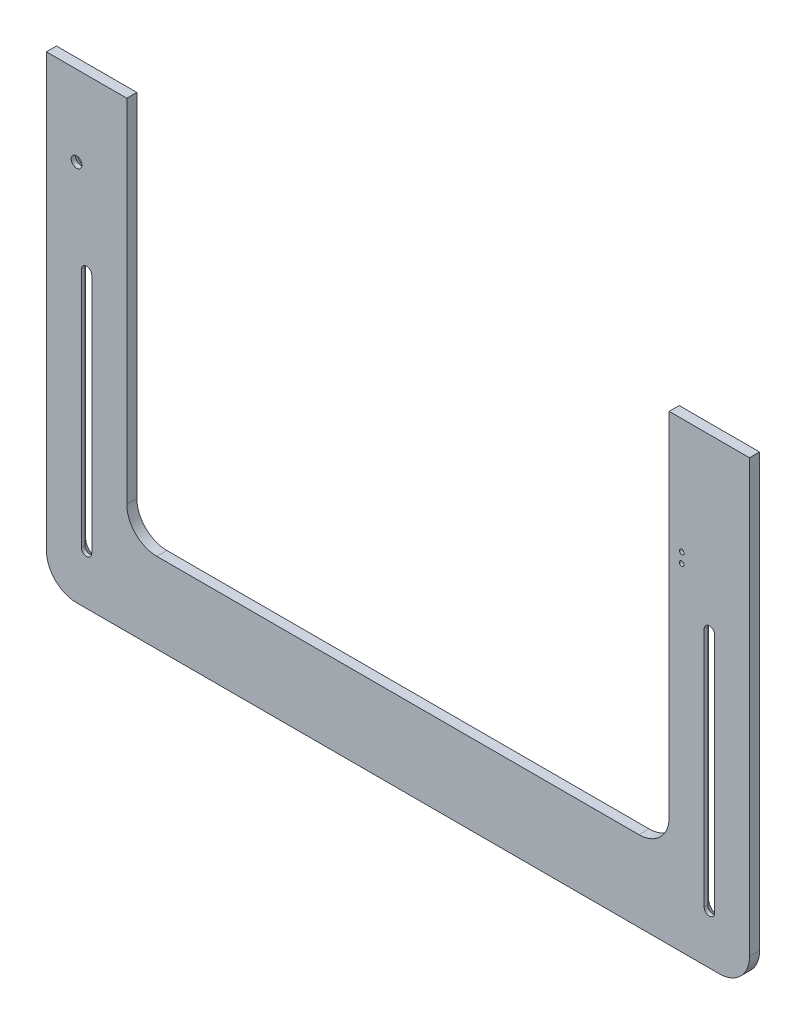
from build123d import *
from OCP.BRepFilletAPI import BRepFilletAPI_MakeChamfer

# Parameters (mm, degrees)
BOSS_EXTRUDE1_DEPTH             = 6.35
FILLET5_R                       = 19.05
FILLET6_R                       = 19.05
FILLET7_R                       = 19.05
FILLET8_R                       = 19.05
CUT_EXTRUDE1_DEPTH              = 532.923850283
CUT_EXTRUDE2_DEPTH              = 532.923850283
CHAMFER1_SIZE                   = 4.0894
CHAMFER1_SIZE2                  = 3.682112299
CHAMFER2_SIZE                   = 4.0894
CHAMFER2_SIZE2                  = 3.682112299
F_32_0_116_DIAMETER_HOLE1_D     = 2.9464
F_32_0_116_DIAMETER_HOLE1_DEPTH = 25.4
F_32_0_116_DIAMETER_HOLE1_TIP   = 0.885187864


with BuildPart() as part:
    # Sketch1 → Boss-Extrude1 (new body)
    with BuildSketch(Plane.XY):
        Polygon((0, 0), (0, -292.1), (444.5, -292.1), (444.5, 0), (393.7, 0), (393.7, -241.3), (50.8, -241.3), (50.8, 0), align=None)
    extrude(amount=BOSS_EXTRUDE1_DEPTH)

    # Fillet5
    fillet5_edges = [part.edges().sort_by_distance(p)[0] for p in [
        (0, -292.1, 3.175),
    ]]
    fillet(fillet5_edges, radius=FILLET5_R)

    # Fillet6
    fillet6_edges = [part.edges().sort_by_distance(p)[0] for p in [
        (444.5, -292.1, 3.175),
    ]]
    fillet(fillet6_edges, radius=FILLET6_R)

    # Fillet7
    fillet7_edges = [part.edges().sort_by_distance(p)[0] for p in [
        (50.8, -241.3, 3.175),
    ]]
    fillet(fillet7_edges, radius=FILLET7_R)

    # Fillet8
    fillet8_edges = [part.edges().sort_by_distance(p)[0] for p in [
        (393.7, -241.3, 3.175),
    ]]
    fillet(fillet8_edges, radius=FILLET8_R)

    # Sketch2 → Cut-Extrude1 (cut, through all)
    with BuildSketch(Plane.XY.offset(6.35)):
        with BuildLine():
            Line((22.1361, -260.35), (22.1361, -107.95))
            ThreePointArc((22.1361, -107.95), (25.4, -104.6861), (28.6639, -107.95))
            Line((28.6639, -107.95), (28.6639, -260.35))
            ThreePointArc((28.6639, -260.35), (25.4, -263.6139), (22.1361, -260.35))
        make_face()
    extrude(amount=-CUT_EXTRUDE1_DEPTH, mode=Mode.SUBTRACT)

    # Sketch4 → Cut-Extrude2 (cut, through all)
    with BuildSketch(Plane.XY.offset(6.35)):
        with BuildLine():
            Line((415.8361, -260.35), (415.8361, -107.95))
            ThreePointArc((415.8361, -107.95), (419.1, -104.6861), (422.3639, -107.95))
            Line((422.3639, -107.95), (422.3639, -260.35))
            ThreePointArc((422.3639, -260.35), (419.1, -263.6139), (415.8361, -260.35))
        make_face()
    extrude(amount=-CUT_EXTRUDE2_DEPTH, mode=Mode.SUBTRACT)

    # Sketch10 → CSK for 1/4 Flat Head Machine Screw2 (revolve, cut)
    with BuildSketch(Plane(origin=(19.05, -50.8, 0), x_dir=(0, 1, 0), z_dir=(1, 0, 0))):
        Polygon((0, 0), (0, 6.35), (3.3782, 6.35), (3.3782, 3.520932584), (6.4389, 0), align=None)
    revolve(axis=Axis((19.05, -50.8, -6.35), (0, 0, 1)), mode=Mode.SUBTRACT)

    # Chamfer1: one chamfer whose edges measure the first distance from different faces: ONE call of the kernel's chamfer builder (chamfer() names one face for all edges)
    chamfer1_edges_1 = [part.edges().sort_by_distance(p)[0] for p in [
        (419.1, -263.6139, 0),
    ]]
    chamfer1_side_1 = [part.faces().sort_by_distance(p)[0] for p in [
        (419.1, -263.6139, 3.175),
    ]]
    chamfer1_edges_2 = [part.edges().sort_by_distance(p)[0] for p in [
        (415.8361, -184.15, 0),
    ]]
    chamfer1_side_2 = [part.faces().sort_by_distance(p)[0] for p in [
        (415.8361, -184.15, 3.175),
    ]]
    chamfer1_edges_3 = [part.edges().sort_by_distance(p)[0] for p in [
        (419.1, -104.6861, 0),
    ]]
    chamfer1_side_3 = [part.faces().sort_by_distance(p)[0] for p in [
        (419.1, -104.6861, 3.175),
    ]]
    chamfer1_edges_4 = [part.edges().sort_by_distance(p)[0] for p in [
        (422.3639, -184.15, 0),
    ]]
    chamfer1_side_4 = [part.faces().sort_by_distance(p)[0] for p in [
        (422.3639, -184.15, 3.175),
    ]]
    chamfer1 = BRepFilletAPI_MakeChamfer(part.part.solid().wrapped)
    for e in chamfer1_edges_1:
        chamfer1.Add(CHAMFER1_SIZE, CHAMFER1_SIZE2, e.wrapped, chamfer1_side_1[0].wrapped)  # the first distance lies on this face
    for e in chamfer1_edges_2:
        chamfer1.Add(CHAMFER1_SIZE, CHAMFER1_SIZE2, e.wrapped, chamfer1_side_2[0].wrapped)  # the first distance lies on this face
    for e in chamfer1_edges_3:
        chamfer1.Add(CHAMFER1_SIZE, CHAMFER1_SIZE2, e.wrapped, chamfer1_side_3[0].wrapped)  # the first distance lies on this face
    for e in chamfer1_edges_4:
        chamfer1.Add(CHAMFER1_SIZE, CHAMFER1_SIZE2, e.wrapped, chamfer1_side_4[0].wrapped)  # the first distance lies on this face
    add(Compound.cast(chamfer1.Shape()), mode=Mode.REPLACE)

    # Chamfer2: one chamfer whose edges measure the first distance from different faces: ONE call of the kernel's chamfer builder (chamfer() names one face for all edges)
    chamfer2_edges_1 = [part.edges().sort_by_distance(p)[0] for p in [
        (25.4, -263.6139, 0),
    ]]
    chamfer2_side_1 = [part.faces().sort_by_distance(p)[0] for p in [
        (25.4, -263.6139, 3.175),
    ]]
    chamfer2_edges_2 = [part.edges().sort_by_distance(p)[0] for p in [
        (25.4, -104.6861, 0),
    ]]
    chamfer2_side_2 = [part.faces().sort_by_distance(p)[0] for p in [
        (25.4, -104.6861, 3.175),
    ]]
    chamfer2_edges_3 = [part.edges().sort_by_distance(p)[0] for p in [
        (28.6639, -184.15, 0),
    ]]
    chamfer2_side_3 = [part.faces().sort_by_distance(p)[0] for p in [
        (28.6639, -184.15, 3.175),
    ]]
    chamfer2_edges_4 = [part.edges().sort_by_distance(p)[0] for p in [
        (22.1361, -184.15, 0),
    ]]
    chamfer2_side_4 = [part.faces().sort_by_distance(p)[0] for p in [
        (22.1361, -184.15, 3.175),
    ]]
    chamfer2 = BRepFilletAPI_MakeChamfer(part.part.solid().wrapped)
    for e in chamfer2_edges_1:
        chamfer2.Add(CHAMFER2_SIZE, CHAMFER2_SIZE2, e.wrapped, chamfer2_side_1[0].wrapped)  # the first distance lies on this face
    for e in chamfer2_edges_2:
        chamfer2.Add(CHAMFER2_SIZE, CHAMFER2_SIZE2, e.wrapped, chamfer2_side_2[0].wrapped)  # the first distance lies on this face
    for e in chamfer2_edges_3:
        chamfer2.Add(CHAMFER2_SIZE, CHAMFER2_SIZE2, e.wrapped, chamfer2_side_3[0].wrapped)  # the first distance lies on this face
    for e in chamfer2_edges_4:
        chamfer2.Add(CHAMFER2_SIZE, CHAMFER2_SIZE2, e.wrapped, chamfer2_side_4[0].wrapped)  # the first distance lies on this face
    add(Compound.cast(chamfer2.Shape()), mode=Mode.REPLACE)

    # #32 (0.116) Diameter Hole1
    with Locations(Plane.XY.offset(6.35)):
        with Locations((401.6375, -73.025), (401.6375, -79.375)):
            Hole(F_32_0_116_DIAMETER_HOLE1_D / 2, depth=F_32_0_116_DIAMETER_HOLE1_DEPTH)
            with Locations((0, 0, -(F_32_0_116_DIAMETER_HOLE1_DEPTH + F_32_0_116_DIAMETER_HOLE1_TIP / 2))):  # 118° drill point
                Cone(0, F_32_0_116_DIAMETER_HOLE1_D / 2, F_32_0_116_DIAMETER_HOLE1_TIP, mode=Mode.SUBTRACT)


solid = part.part
